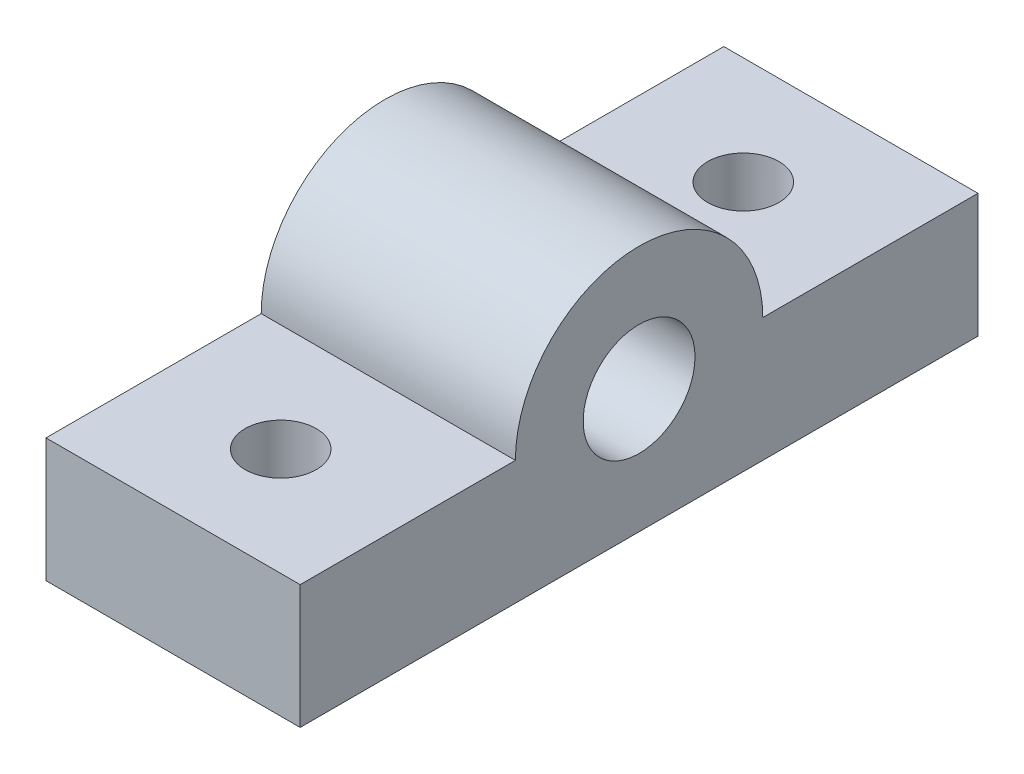
from build123d import *

# Parameters (mm, degrees)
CROQUIS1_R              = 3.3
SALIENTE_EXTRUIR1_DEPTH = 7.5
CORTAR_EXTRUIR1_REACH   = 24.573
CROQUIS2_R              = 2.1


with BuildPart() as part:
    # Croquis1 → Saliente-Extruir1 (new, symmetric)
    with BuildSketch(Plane(origin=(0, 0, 0), x_dir=(0, 0, -1), z_dir=(1, 0, 0))):
        with BuildLine():
            Line((-20, 0), (20, 0))
            Line((20, 0), (20, 7.3))
            Line((20, 7.3), (7.3, 7.3))
            ThreePointArc((7.3, 7.3), (0, 14.6), (-7.3, 7.3))
            Line((-7.3, 7.3), (-20, 7.3))
            Line((-20, 7.3), (-20, 0))
        make_face()
        with Locations((0, 7.3)):
            Circle(CROQUIS1_R, mode=Mode.SUBTRACT)
    extrude(amount=SALIENTE_EXTRUIR1_DEPTH, both=True)

    # Croquis2 → Cortar-Extruir1 (cut, up to next)
    with BuildSketch(Plane(origin=(0, 7.3, 0), x_dir=(1, 0, 0), z_dir=(0, 1, 0)), mode=Mode.PRIVATE) as cortar_extruir1_sk1:
        with Locations(Location((0, -13.65, 0), (0, 0, 270))):
            Circle(CROQUIS2_R)
    cortar_extruir1_tool1 = extrude(cortar_extruir1_sk1.sketch, amount=-CORTAR_EXTRUIR1_REACH, mode=Mode.PRIVATE) & part.part
    # Croquis2 → Cortar-Extruir1 (cut, up to next)
    with BuildSketch(Plane(origin=(0, 7.3, 0), x_dir=(1, 0, 0), z_dir=(0, 1, 0)), mode=Mode.PRIVATE) as cortar_extruir1_sk2:
        with Locations(Location((0, 13.65, 0), (0, 0, 270))):
            Circle(CROQUIS2_R)
    cortar_extruir1_tool2 = extrude(cortar_extruir1_sk2.sketch, amount=-CORTAR_EXTRUIR1_REACH, mode=Mode.PRIVATE) & part.part
    add(cortar_extruir1_tool1.solids().sort_by_distance((0, 7.3, 13.65))[0], mode=Mode.SUBTRACT)
    add(cortar_extruir1_tool2.solids().sort_by_distance((0, 7.3, -13.65))[0], mode=Mode.SUBTRACT)


solid = part.part
